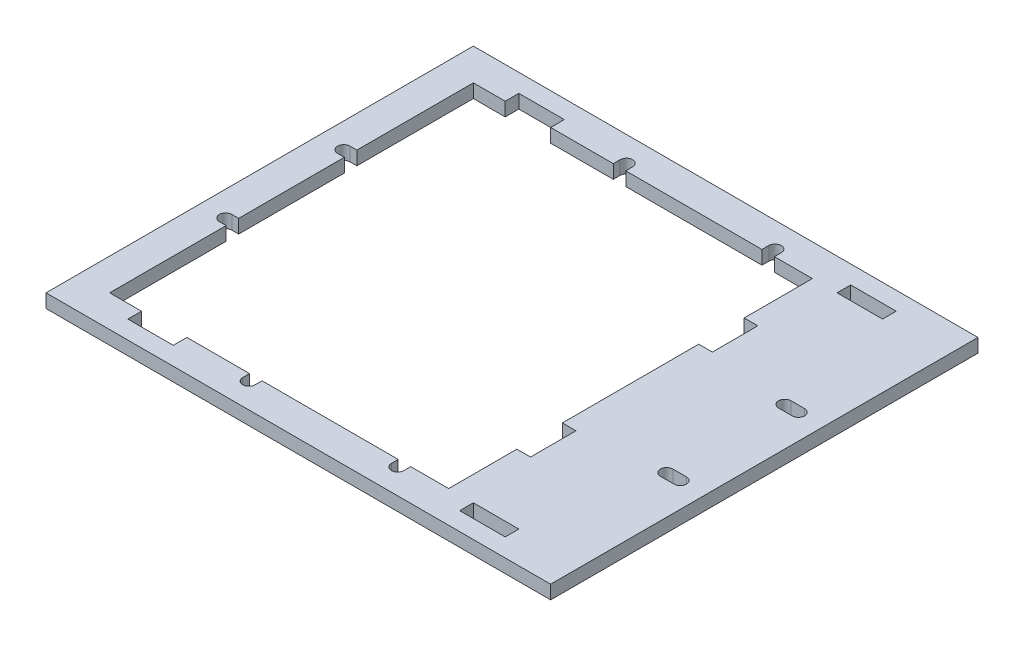
from build123d import *

# Parameters (mm, degrees)
CROQUIS1_W              = 111
CROQUIS1_H              = 94
CROQUIS1_W_2            = 10
CROQUIS1_H_2            = 3
SALIENTE_EXTRUIR1_DEPTH = 3


with BuildPart() as part:
    # Croquis1 → Saliente-Extruir1 (new body)
    with BuildSketch(Plane(origin=(0, 0, 0), x_dir=(1, 0, 0), z_dir=(0, 1, 0))):
        with Locations((48.5, 40)):
            Rectangle(CROQUIS1_W, CROQUIS1_H)
        with BuildLine():
            Line((7, 0), (0, 0))
            Line((0, 0), (0, 25.625))
            Line((0, 25.625), (-1.5, 25.625))
            ThreePointArc((-1.5, 25.625), (-2.875, 27), (-1.5, 28.375))
            Line((-1.5, 28.375), (0, 28.375))
            Line((0, 28.375), (0, 51.625))
            Line((0, 51.625), (-1.5, 51.625))
            ThreePointArc((-1.5, 51.625), (-2.875, 53), (-1.5, 54.375))
            Line((-1.5, 54.375), (0, 54.375))
            Line((0, 54.375), (0, 80))
            Line((0, 80), (7, 80))
            Line((7, 80), (7, 83))
            Line((7, 83), (17, 83))
            Line((17, 83), (17, 80))
            Line((17, 80), (30.775145502, 80))
            Line((30.775145502, 80), (30.775000006, 81.499866617))
            ThreePointArc((30.775000006, 81.499866617), (32.149933309, 82.874999998), (33.525, 81.5))
            Line((33.525, 81.5), (33.525, 80))
            Line((33.525, 80), (63.475, 80))
            Line((63.475, 80), (63.475, 81.500066988))
            ThreePointArc((63.475, 81.500066988), (64.850028215, 82.875038772), (66.225, 81.500010557))
            Line((66.225, 81.500010557), (66.225, 80))
            Line((66.225, 80), (66.475145502, 80))
            Line((66.475145502, 80), (74.57, 80))
            Line((74.57, 80), (74.57, 65))
            Line((74.57, 65), (77.57, 65))
            Line((77.57, 65), (77.57, 55))
            Line((77.57, 55), (74.57, 55))
            Line((74.57, 55), (74.57, 25))
            Line((74.57, 25), (77.57, 25))
            Line((77.57, 25), (77.57, 15))
            Line((77.57, 15), (74.57, 15))
            Line((74.57, 15), (74.57, 0))
            Line((74.57, 0), (66.225, 0))
            Line((66.225, 0), (66.225, -1.500010557))
            ThreePointArc((66.225, -1.500010557), (64.850028215, -2.875038772), (63.475, -1.500066988))
            Line((63.475, -1.500066988), (63.475, 0))
            Line((63.475, 0), (33.525, 0))
            Line((33.525, 0), (33.525, -1.5))
            ThreePointArc((33.525, -1.5), (32.149933309, -2.874999998), (30.775000006, -1.499866617))
            Line((30.775000006, -1.499866617), (30.775145502, 0))
            Line((30.775145502, 0), (17, 0))
            Line((17, 0), (17, -3))
            Line((17, -3), (7, -3))
            Line((7, -3), (7, 0))
        make_face(mode=Mode.SUBTRACT)
        with Locations((85, -1.5)):
            Rectangle(CROQUIS1_W_2, CROQUIS1_H_2, mode=Mode.SUBTRACT)
        with BuildLine():
            ThreePointArc((98.5, 28.375), (99.875, 27), (98.5, 25.625))
            Line((98.5, 25.625), (95.5, 25.625))
            ThreePointArc((95.5, 25.625), (94.125, 27), (95.5, 28.375))
            Line((95.5, 28.375), (98.5, 28.375))
        make_face(mode=Mode.SUBTRACT)
        with BuildLine():
            ThreePointArc((98.5, 54.375), (99.875, 53), (98.5, 51.625))
            Line((98.5, 51.625), (95.5, 51.625))
            ThreePointArc((95.5, 51.625), (94.125, 53), (95.5, 54.375))
            Line((95.5, 54.375), (98.5, 54.375))
        make_face(mode=Mode.SUBTRACT)
        with Locations((85, 81.5)):
            Rectangle(CROQUIS1_W_2, CROQUIS1_H_2, mode=Mode.SUBTRACT)
    extrude(amount=SALIENTE_EXTRUIR1_DEPTH)


solid = part.part
